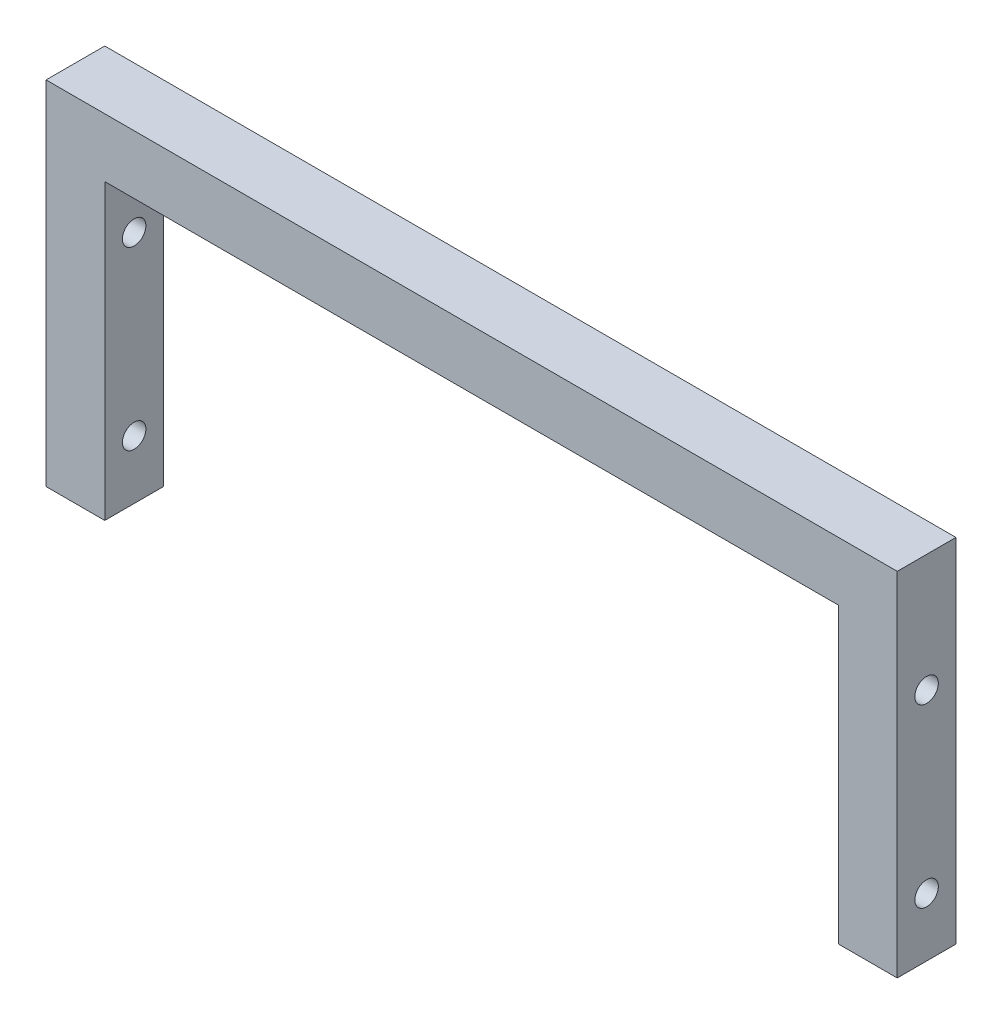
from build123d import *

# Parameters (mm, degrees)
BOSS_EXTRUDE1_DEPTH     = 10
CUT_EXTRUDE1_DEPTH      = 158.241851935
CUT_EXTRUDE1_DEPTH_BACK = 158.241851935
SKETCH4_R               = 2


with BuildPart() as part:
    # Sketch1 → Boss-Extrude1 (new body)
    with BuildSketch(Plane.XY):
        Polygon((0, 0), (0, 60), (145, 60), (145, 0), (135, 0), (135, 50), (10, 50), (10, 0), align=None)
    extrude(amount=BOSS_EXTRUDE1_DEPTH)

    # Sketch4 → Cut-Extrude1 (cut, two sides: drawn at the far end of the back side and taken through both)
    with BuildSketch(Plane(origin=(145, 0, 0), x_dir=(0, 0, -1), z_dir=(1, 0, 0)).offset(-CUT_EXTRUDE1_DEPTH_BACK)):
        with Locations((-5, 10)):
            Circle(SKETCH4_R)
        with Locations((-5, 40)):
            Circle(SKETCH4_R)
    extrude(amount=CUT_EXTRUDE1_DEPTH + CUT_EXTRUDE1_DEPTH_BACK, mode=Mode.SUBTRACT)


solid = part.part
